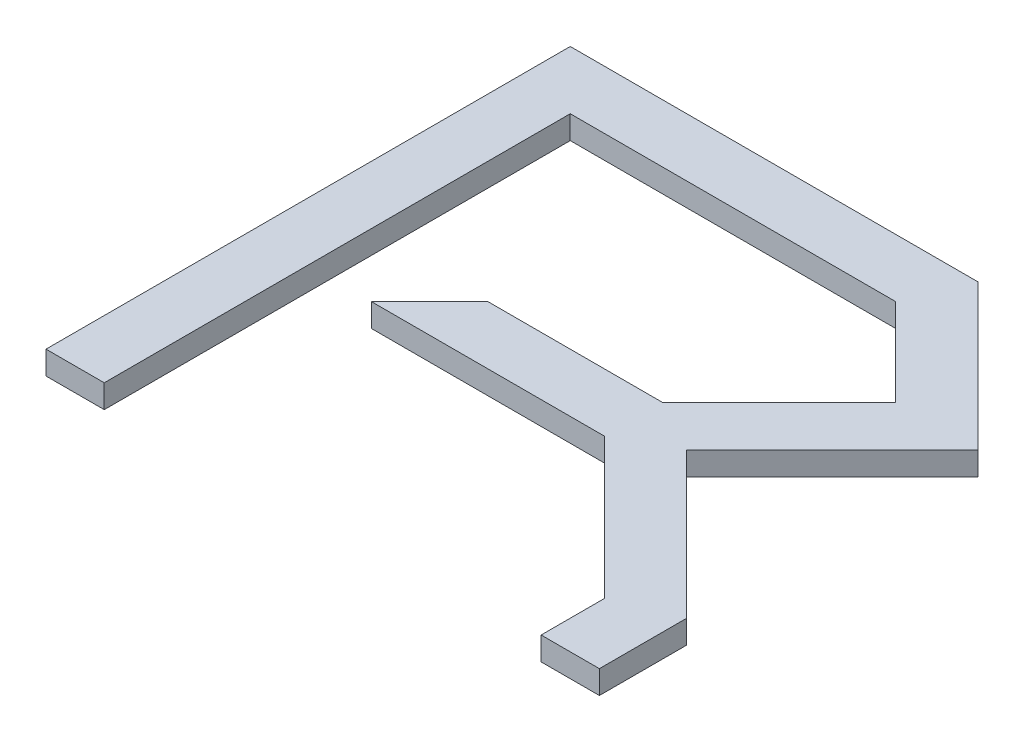
from build123d import *

# Parameters (mm, degrees)
BOSS_EXTRUDE1_DEPTH = 2


with BuildPart() as part:
    # Sketch2 → Boss-Extrude1 (new body)
    with BuildSketch(Plane(origin=(0, 0, 0), x_dir=(1, 0, 0), z_dir=(0, 1, 0))):
        Polygon((-12.5, 20), (15.428932188, 20), (22.928932188, 12.5), (12.928932188, 2.5), (-2.071067812, 2.5), (-7.071067812, -2.5), (12.928932188, -2.5), (25, -14.571067812), (25, -20), (30, -20), (30, -12.5), (17.5, 0), (30, 12.5), (17.5, 25), (-17.5, 25), (-17.5, -20), (-12.5, -20), align=None)
    extrude(amount=BOSS_EXTRUDE1_DEPTH)


solid = part.part
